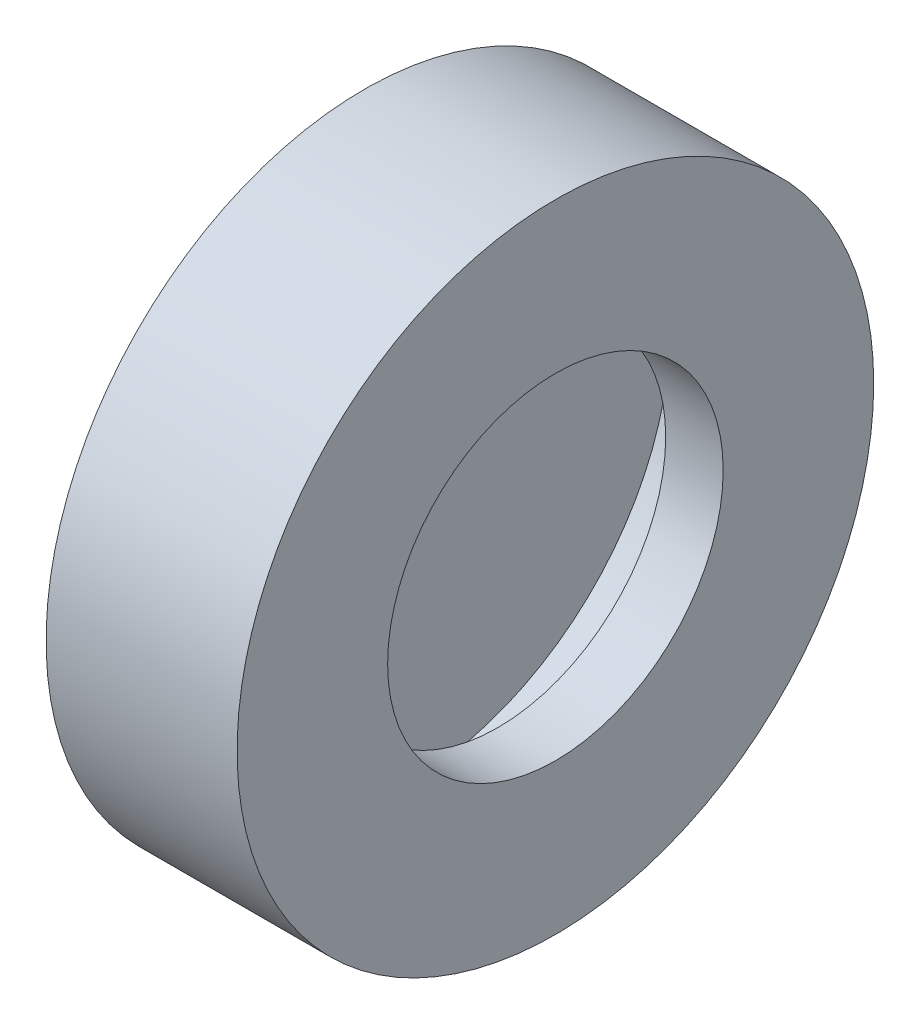
from build123d import *

# Parameters (mm, degrees)
SKETCH1_R           = 5
BOSS_EXTRUDE1_DEPTH = 3


with BuildPart() as part:
    # Sketch1 → Boss-Extrude1 (new body)
    with BuildSketch(Plane(origin=(0, 0, 0), x_dir=(0, 0, -1), z_dir=(1, 0, 0))):
        Circle(SKETCH1_R)
    extrude(amount=BOSS_EXTRUDE1_DEPTH)

    # Sketch2 → Cut-Revolve1 (revolve, cut)
    with BuildSketch(Plane(origin=(0, 0, 0), x_dir=(1, 0, 0), z_dir=(0, 1, 0))):
        Polygon((3, 2.635374789), (2.09701047, 2.635374789), (2.09701047, 4.136429685), (0.664185342, 4.136429685), (0.664185342, 0), (3.615122808, 0), (3.615122808, 2.635374789), align=None)
    revolve(axis=Axis((3.615122808, 0, 0), (-1, 0, 0)), mode=Mode.SUBTRACT)


solid = part.part
